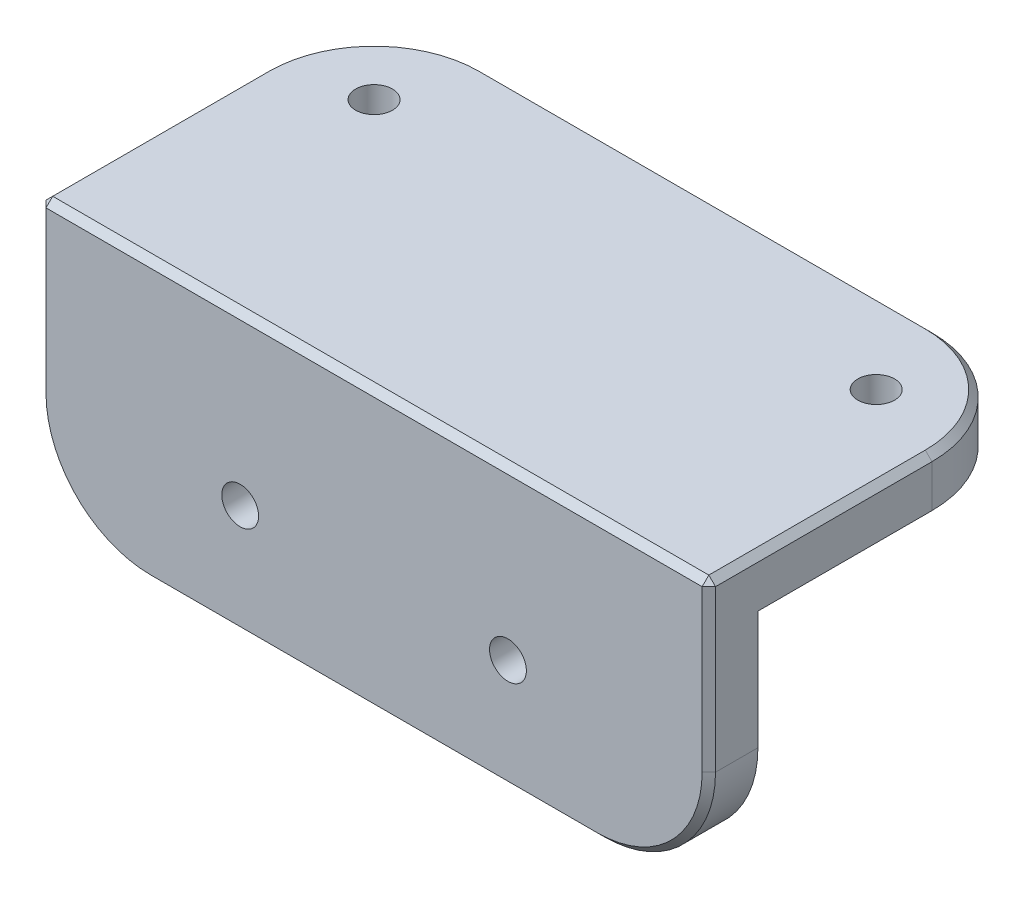
from build123d import *

# Parameters (mm, degrees)
SKETCH1_W           = 60
SKETCH1_H           = 30
BOSS_EXTRUDE1_DEPTH = 5
SKETCH2_R           = 1.65
CUT_EXTRUDE1_DEPTH  = 34.911649916
SKETCH3_W           = 60
SKETCH3_H           = 5
BOSS_EXTRUDE2_DEPTH = 20
SKETCH4_R           = 1.65
CUT_EXTRUDE2_DEPTH  = 10
FILLET1_R           = 10
CHAMFER1_SIZE       = 0.6


with BuildPart() as part:
    # Sketch1 → Boss-Extrude1 (new body)
    with BuildSketch(Plane(origin=(0, 0, 0), x_dir=(1, 0, 0), z_dir=(0, 1, 0))):
        Rectangle(SKETCH1_W, SKETCH1_H)
    extrude(amount=BOSS_EXTRUDE1_DEPTH)

    # Sketch2 → Cut-Extrude1 (cut, through all)
    with BuildSketch(Plane(origin=(0, 5, 0), x_dir=(1, 0, 0), z_dir=(0, 1, 0))):
        with Locations(Location((-22.5, 7.5, 0), (0, 0, 270))):
            Circle(SKETCH2_R)
        with Locations(Location((22.5, 7.5, 0), (0, 0, 270))):
            Circle(SKETCH2_R)
    extrude(amount=-CUT_EXTRUDE1_DEPTH, mode=Mode.SUBTRACT)

    # Sketch3 → Boss-Extrude2 (add)
    with BuildSketch(Plane.XZ):
        with Locations((0, 12.5)):
            Rectangle(SKETCH3_W, SKETCH3_H)
    extrude(amount=BOSS_EXTRUDE2_DEPTH)

    # Sketch4 → Cut-Extrude2 (cut)
    with BuildSketch(Plane(origin=(0, 0, 10), x_dir=(-1, 0, 0), z_dir=(0, 0, -1))):
        with Locations((-12, -10)):
            Circle(SKETCH4_R)
        with Locations((12, -10)):
            Circle(SKETCH4_R)
    extrude(amount=-CUT_EXTRUDE2_DEPTH, mode=Mode.SUBTRACT)

    # Fillet1
    fillet1_edges = [part.edges().sort_by_distance(p)[0] for p in [
        (-30, -20, 12.5),
        (30, -20, 12.5),
        (-30, 2.5, -15),
        (30, 2.5, -15),
    ]]
    fillet(fillet1_edges, radius=FILLET1_R)

    # Chamfer1
    chamfer1_edges = [part.edges().sort_by_distance(p)[0] for p in [
        (0, 5, 15),
        (30, 0, 2.5),
        (0, -20, 10),
        (0, -20, 15),
        (30, -5, 10),
        (-30, -5, 10),
        (27.071067812, -17.071067812, 10),
        (-27.071067812, -17.071067812, 10),
        (30, 5, 5),
        (-30, 0, 2.5),
        (-30, 5, 5),
        (27.071067812, -17.071067812, 15),
        (-27.071067812, -17.071067812, 15),
        (0, 0, -15),
        (27.071067812, 0, -12.071067812),
        (-27.071067812, 0, -12.071067812),
        (0, 5, -15),
        (27.071067812, 5, -12.071067812),
        (-27.071067812, 5, -12.071067812),
        (30, -2.5, 15),
        (-30, -2.5, 15),
    ]]
    chamfer(chamfer1_edges, length=CHAMFER1_SIZE)


solid = part.part
